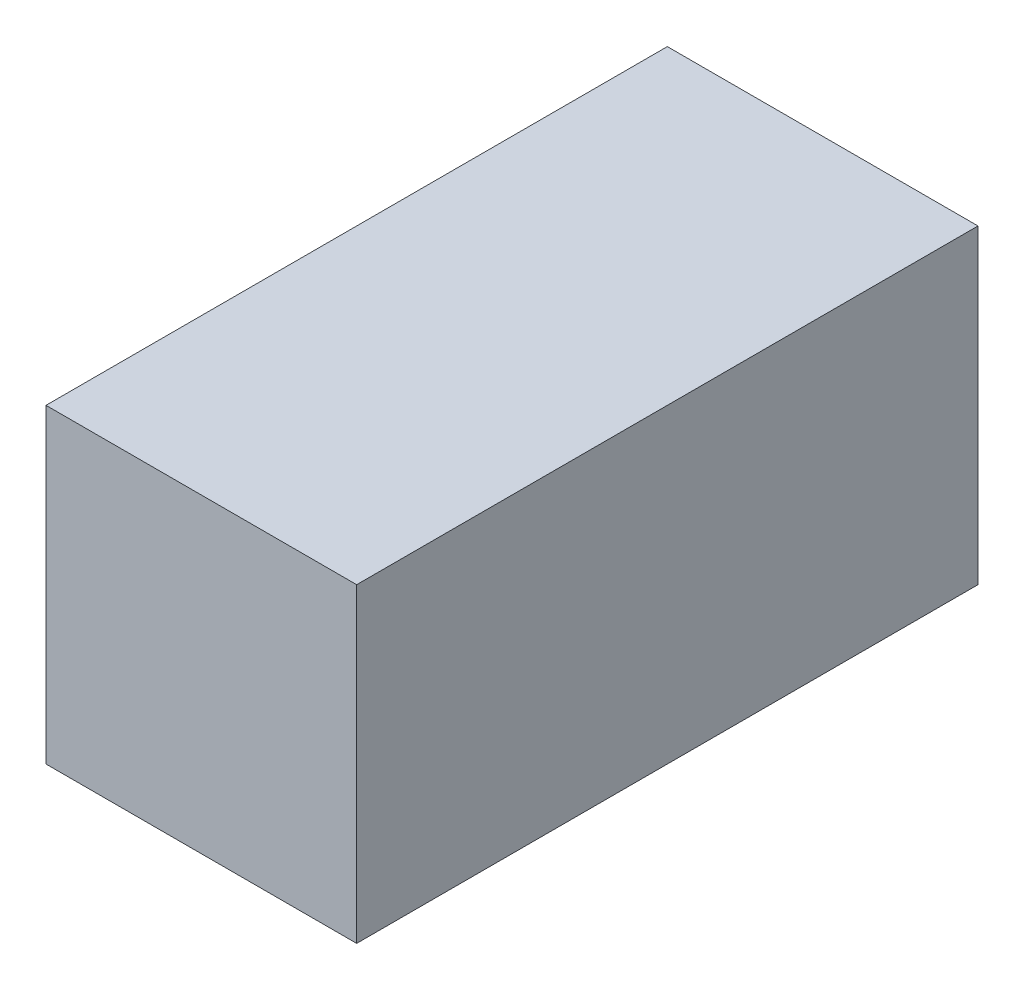
from build123d import *

# Parameters (mm, degrees)
SKETCH1_W           = 5.08
SKETCH1_H           = 5.08
BOSS_EXTRUDE1_DEPTH = 10.16


with BuildPart() as part:
    # Sketch1 → Boss-Extrude1 (new body)
    with BuildSketch(Plane.XY):
        with Locations((2.54, 2.54)):
            Rectangle(SKETCH1_W, SKETCH1_H)
    extrude(amount=BOSS_EXTRUDE1_DEPTH)


solid = part.part
